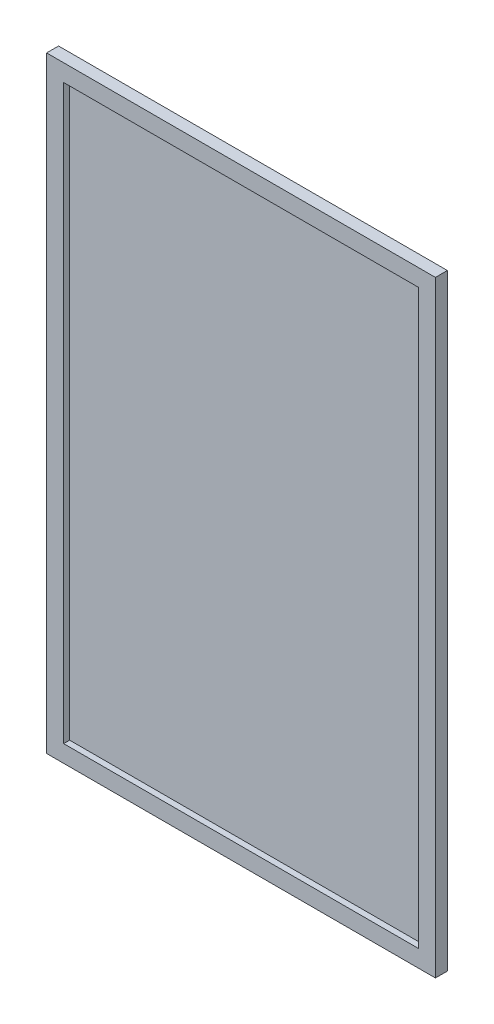
from build123d import *

# Parameters (mm, degrees)
SKETCH1_W           = 2311.4
SKETCH1_H           = 3606.8
BOSS_EXTRUDE1_DEPTH = 71.12
SKETCH2_W           = 2108.2
SKETCH2_H           = 3403.6
CUT_EXTRUDE1_DEPTH  = 35.56


with BuildPart() as part:
    # Sketch1 → Boss-Extrude1 (new body)
    with BuildSketch(Plane.XY):
        with Locations((1155.7, 1803.4)):
            Rectangle(SKETCH1_W, SKETCH1_H)
    extrude(amount=BOSS_EXTRUDE1_DEPTH)

    # Sketch2 → Cut-Extrude1 (cut)
    with BuildSketch(Plane.XY.offset(71.12)):
        with Locations((1155.7, 1803.4)):
            Rectangle(SKETCH2_W, SKETCH2_H)
    extrude(amount=-CUT_EXTRUDE1_DEPTH, mode=Mode.SUBTRACT)


solid = part.part
